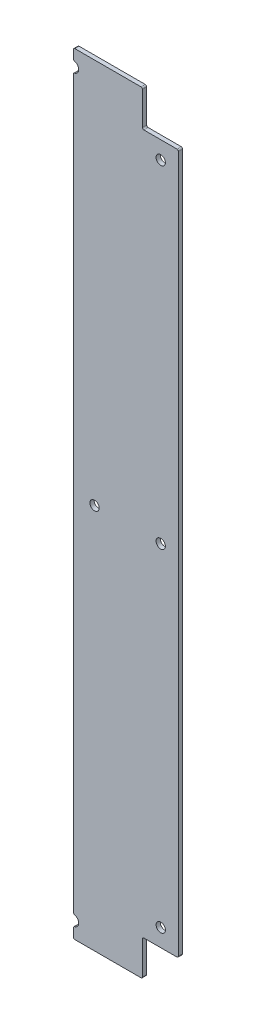
from build123d import *

# Parameters (mm, degrees)
BOSS_EXTRUDE1_DEPTH  = 3
M6_CLEARANCE_HOLE1_D = 6.6
M6_CLEARANCE_HOLE2_D = 6.6
SKETCH6_R            = 3.75
CUT_EXTRUDE1_DEPTH   = 532.991776252
FILLET1_R            = 1


with BuildPart() as part:
    # Sketch1 → Boss-Extrude1 (new body)
    with BuildSketch(Plane.XY):
        Polygon((25.5, 522.5), (25.5, -25.5), (74.5, -25.5), (74.5, 0), (100, 0), (100, 497), (74.5, 497), (74.5, 522.5), align=None)
    extrude(amount=BOSS_EXTRUDE1_DEPTH)

    # M6 Clearance Hole1 (through all)
    with Locations(Plane(origin=(0, 0, 0), x_dir=(-1, 0, 0), z_dir=(0, 0, -1))):
        with Locations((-87.5, 12.5), (-87.5, 484.5), (-87.5, 248.5)):
            Hole(M6_CLEARANCE_HOLE1_D / 2)

    # M6 Clearance Hole2 (through all)
    with Locations(Plane(origin=(0, 0, 0), x_dir=(-1, 0, 0), z_dir=(0, 0, -1))):
        with Locations((-40.5, 248.5)):
            Hole(M6_CLEARANCE_HOLE2_D / 2)

    # Sketch6 → Cut-Extrude1 (cut, through all)
    with BuildSketch(Plane(origin=(0, 0, 0), x_dir=(-1, 0, 0), z_dir=(0, 0, -1))):
        with Locations((-25.5, -14)):
            Circle(SKETCH6_R)
        with Locations((-25.5, 511)):
            Circle(SKETCH6_R)
    extrude(amount=-CUT_EXTRUDE1_DEPTH, mode=Mode.SUBTRACT)

    # Fillet1
    fillet1_edges = [part.edges().sort_by_distance(p)[0] for p in [
        (74.5, -25.5, 1.5),
        (25.5, -25.5, 1.5),
        (25.5, 522.5, 1.5),
        (74.5, 522.5, 1.5),
        (74.5, 497, 1.5),
        (100, 497, 1.5),
        (100, 0, 1.5),
        (74.5, 0, 1.5),
        (25.5, -17.75, 1.5),
        (25.5, -10.25, 1.5),
        (25.5, 507.25, 1.5),
        (25.5, 514.75, 1.5),
    ]]
    fillet(fillet1_edges, radius=FILLET1_R)


solid = part.part
